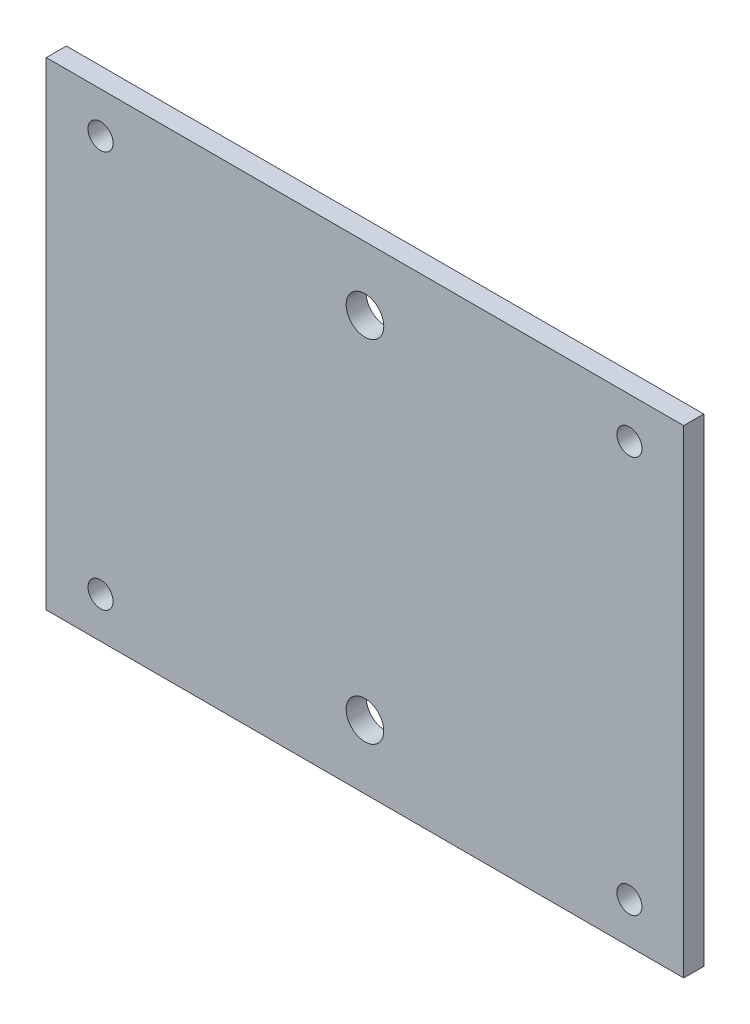
from build123d import *

# Parameters (mm, degrees)
SKETCH1_W           = 50.84
SKETCH1_H           = 38.15
SKETCH1_R           = 1.5
SKETCH1_R_2         = 1
BOSS_EXTRUDE1_DEPTH = 1.6


with BuildPart() as part:
    # Sketch1 → Boss-Extrude1 (new body)
    with BuildSketch(Plane.XY):
        Rectangle(SKETCH1_W, SKETCH1_H)
        with Locations((0, 13.975)):
            Circle(SKETCH1_R, mode=Mode.SUBTRACT)
        with Locations(Location((0, -13.975, 0), (0, 0, 180))):
            Circle(SKETCH1_R, mode=Mode.SUBTRACT)
        with Locations((-21.088938401, 15.825)):
            Circle(SKETCH1_R_2, mode=Mode.SUBTRACT)
        with Locations(Location((21.088938401, 15.825, 0), (0, 0, 180))):
            Circle(SKETCH1_R_2, mode=Mode.SUBTRACT)
        with Locations((21.088938401, -15.825)):
            Circle(SKETCH1_R_2, mode=Mode.SUBTRACT)
        with Locations(Location((-21.088938401, -15.825, 0), (0, 0, 180))):
            Circle(SKETCH1_R_2, mode=Mode.SUBTRACT)
    extrude(amount=BOSS_EXTRUDE1_DEPTH)


solid = part.part
